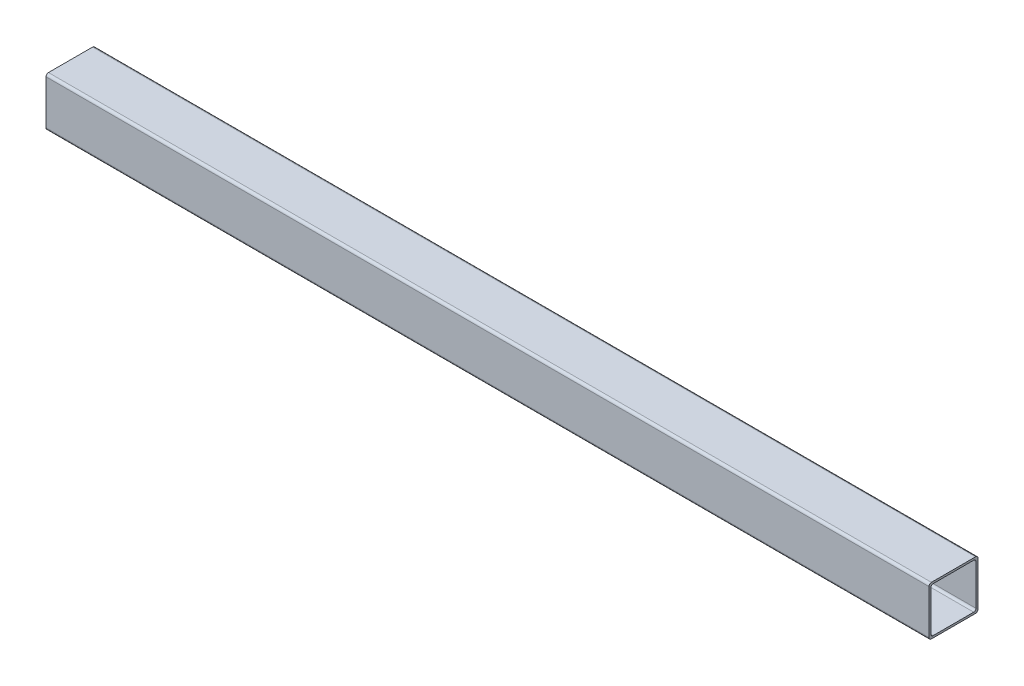
from build123d import *

# Parameters (mm, degrees)
BOSS_EXTRUDE1_DEPTH      = 457.2
BOSS_EXTRUDE1_DEPTH_BACK = 457.2


with BuildPart() as part:
    # Sketch4 → Boss-Extrude1 (new, two sides: drawn at the far end of the back side and taken through both)
    with BuildSketch(Plane(origin=(0, 0, 0), x_dir=(0, 0, -1), z_dir=(1, 0, 0)).offset(-BOSS_EXTRUDE1_DEPTH_BACK)):
        with BuildLine():
            Line((25.4, -22.86), (25.4, 22.86))
            ThreePointArc((25.4, 22.86), (24.656051224, 24.656051224), (22.86, 25.4))
            Line((22.86, 25.4), (-22.86, 25.4))
            ThreePointArc((-22.86, 25.4), (-24.656051224, 24.656051224), (-25.4, 22.86))
            Line((-25.4, 22.86), (-25.4, -22.86))
            ThreePointArc((-25.4, -22.86), (-24.656051224, -24.656051224), (-22.86, -25.4))
            Line((-22.86, -25.4), (22.86, -25.4))
            ThreePointArc((22.86, -25.4), (24.656051224, -24.656051224), (25.4, -22.86))
        make_face()
        with BuildLine():
            Line((23.2918, 20.96262), (23.2918, -20.96262))
            ThreePointArc((23.2918, -20.96262), (22.609598973, -22.609598973), (20.96262, -23.2918))
            Line((20.96262, -23.2918), (-20.96262, -23.2918))
            ThreePointArc((-20.96262, -23.2918), (-22.609598973, -22.609598973), (-23.2918, -20.96262))
            Line((-23.2918, -20.96262), (-23.2918, 20.96262))
            ThreePointArc((-23.2918, 20.96262), (-22.609598973, 22.609598973), (-20.96262, 23.2918))
            Line((-20.96262, 23.2918), (20.96262, 23.2918))
            ThreePointArc((20.96262, 23.2918), (22.609598973, 22.609598973), (23.2918, 20.96262))
        make_face(mode=Mode.SUBTRACT)
    extrude(amount=BOSS_EXTRUDE1_DEPTH + BOSS_EXTRUDE1_DEPTH_BACK)


solid = part.part
